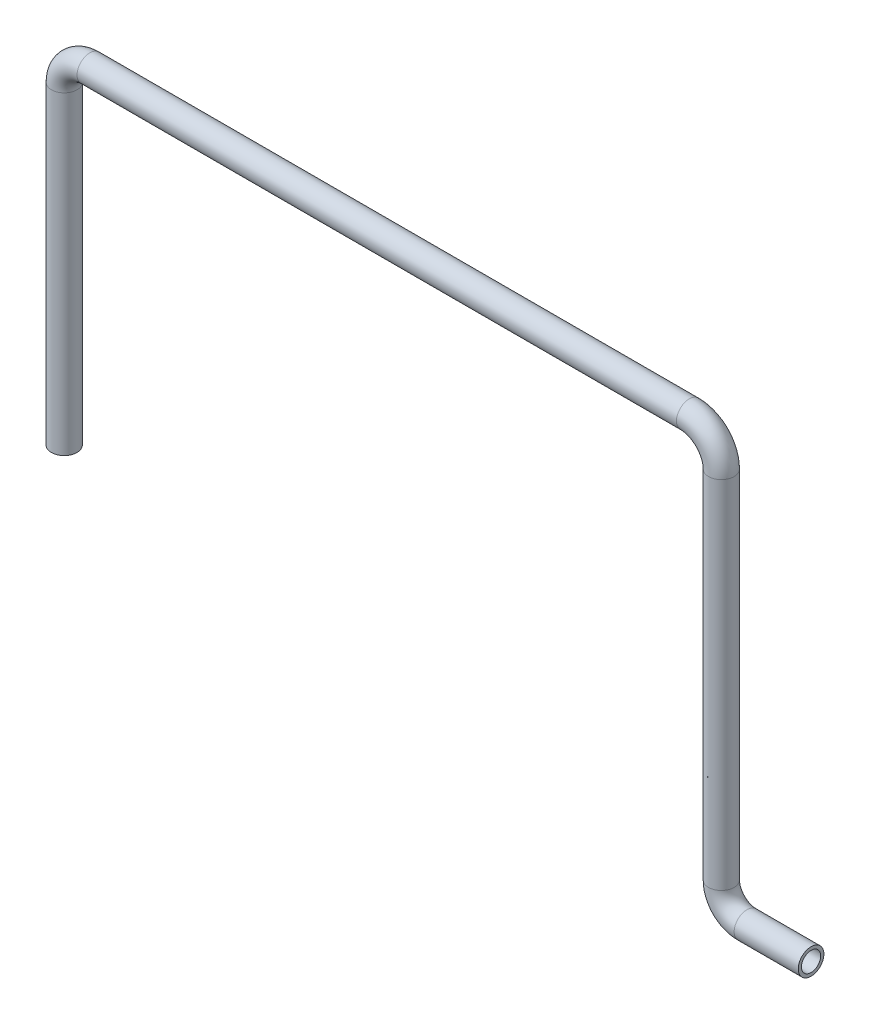
from build123d import *

# Parameters (mm, degrees)
TUBE_PROFILE_R   = 4
TUBE_PROFILE_R_2 = 3


with BuildPart() as part:
    # Tube: sweep along a curve in space
    with BuildLine() as tube_path:
        Line((-145, 44, 95), (-145, 142, 95))
        ThreePointArc((-137, 150, 95), (-142.656854249, 147.656854249, 95), (-145, 142, 95))
        Line((-137, 150, 95), (50, 150, 95))
        ThreePointArc((60, 140, 95), (57.071067812, 147.071067812, 95), (50, 150, 95))
        Line((60, 140, 95), (60, 29, 95))
        ThreePointArc((68, 21, 95), (62.343145751, 23.343145751, 95), (60, 29, 95))
        Line((68, 21, 95), (88, 21, 95))
    # Tube profile (on start of the path) → Tube (sweep)
    with BuildSketch(Plane(origin=(-145, 44, 95), x_dir=(0, 0, 1), z_dir=(0, 1, 0))):
        Circle(TUBE_PROFILE_R)
        Circle(TUBE_PROFILE_R_2, mode=Mode.SUBTRACT)
    sweep(path=tube_path.line)


solid = part.part
